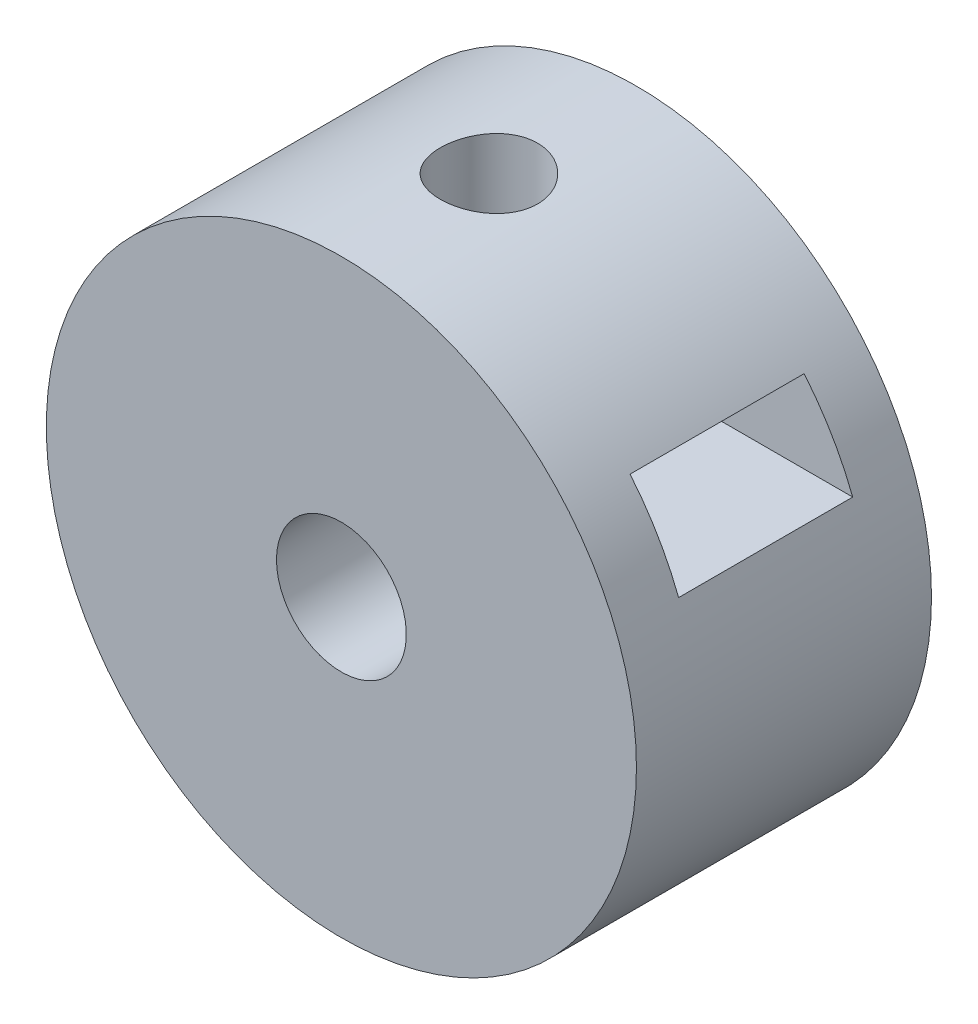
from build123d import *

# Parameters (mm, degrees)
SKETCH_1_R          = 10
EXTRUDE_1_DEPTH     = 10
SKETCH_2_R          = 2.2
CUT_EXTRUDE_2_DEPTH = 10
CUT_EXTRUDE_3_DEPTH = 10
SKETCH_5_R          = 1.65
CUT_EXTRUDE_4_DEPTH = 10
CUT_EXTRUDE_START   = -3.6
CUT_EXTRUDE_5_DEPTH = 2.8


with BuildPart() as part:
    # Эскиз1 → Бобышка-Вытянуть1 (new body)
    with BuildSketch(Plane.XY):
        Circle(SKETCH_1_R)
    extrude(amount=EXTRUDE_1_DEPTH)

    # Эскиз2 → Вырез-Вытянуть2 (cut)
    with BuildSketch(Plane(origin=(0, 0, 0), x_dir=(-1, 0, 0), z_dir=(0, 0, -1))):
        Circle(SKETCH_2_R)
    extrude(amount=-CUT_EXTRUDE_2_DEPTH, mode=Mode.SUBTRACT)

    # Sketch 4 → Вырез-Вытянуть3 (cut)
    with BuildSketch(Plane(origin=(10, 6.4, 7.9), x_dir=(0, -0.4287444523171483, -0.9034258102397056), z_dir=(1, 0, 0))):
        Polygon((0, 0), (5.33021228, 2.529592269), (6.530696747, 0), (1.200484466, -2.529592269), align=None)
    extrude(amount=-CUT_EXTRUDE_3_DEPTH, mode=Mode.SUBTRACT)

    # Эскиз5 → Вырез-Вытянуть4 (cut)
    with BuildSketch(Plane(origin=(0, 10, 0), x_dir=(1, 0, 0), z_dir=(0, 1, 0))):
        with Locations(Location((0, -5, 0), (0, 0, 270))):
            Circle(SKETCH_5_R)
    extrude(amount=-CUT_EXTRUDE_4_DEPTH, mode=Mode.SUBTRACT)

    # Эскиз6 → Вырез-Вытянуть5 (cut)
    with BuildSketch(Plane(origin=(0, 10, 0), x_dir=(1, 0, 0), z_dir=(0, 1, 0)).offset(CUT_EXTRUDE_START)):
        Polygon((-1.703183294, -2.05), (-3.406366588, -5), (-1.703183294, -7.95), (1.703183294, -7.95), (3.406366588, -5), (1.703183294, -2.05), align=None)
    extrude(amount=-CUT_EXTRUDE_5_DEPTH, mode=Mode.SUBTRACT)


solid = part.part
